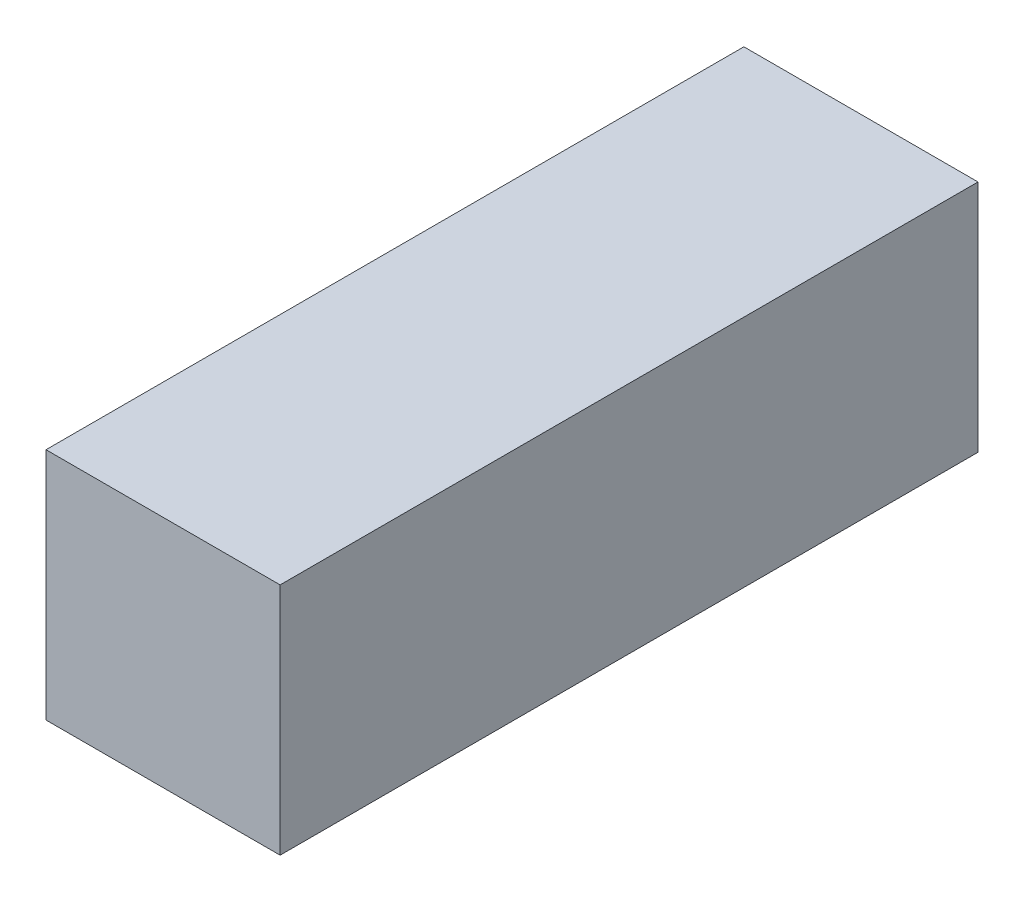
from build123d import *

# Parameters (mm, degrees)
SKETCH1_W            = 2667
SKETCH1_H            = 2667
SKETCH1_W_2          = 2590.8
SKETCH1_H_2          = 2590.8
BOSS_EXTRUDE1_DEPTH  = 7924.8
SKETCH2_W            = 2667
SKETCH2_H            = 2667
BOSS_EXTRUDE2_DEPTH  = 25.4
SKETCH3_W            = 139.7
SKETCH3_H            = 88.9
BOSS_EXTRUDE3_DEPTH  = 4876.8
SKETCH4_W            = 1219.2
SKETCH4_H            = 1016
BOSS_EXTRUDE4_DEPTH  = 152.4
LPATTERN1_COUNT      = 9
LPATTERN1_PITCH      = 142.24
LPATTERN1_COUNT_DIR2 = 9
LPATTERN1_PITCH_DIR2 = 91.44


with BuildPart() as part:
    # Sketch1 → Boss-Extrude1 (new body)
    with BuildSketch(Plane.XY):
        with Locations((0, 1295.4)):
            Rectangle(SKETCH1_W, SKETCH1_H)
        with Locations((0, 1295.4)):
            Rectangle(SKETCH1_W_2, SKETCH1_H_2, mode=Mode.SUBTRACT)
    extrude(amount=BOSS_EXTRUDE1_DEPTH)

    # Sketch2 → Boss-Extrude2 (add)
    with BuildSketch(Plane.XY.offset(7924.8)):
        with Locations((0, 1295.4)):
            Rectangle(SKETCH2_W, SKETCH2_H)
    extrude(amount=BOSS_EXTRUDE2_DEPTH)

    # Sketch3 → Boss-Extrude3 (add)
    with BuildSketch(Plane(origin=(0, 0, 7924.8), x_dir=(-1, 0, 0), z_dir=(0, 0, -1))):
        with Locations((-1225.55, 44.45)):
            Rectangle(SKETCH3_W, SKETCH3_H)
    boss_extrude3 = extrude(amount=BOSS_EXTRUDE3_DEPTH)

    # Sketch4 → Boss-Extrude4 (add)
    with BuildSketch(Plane(origin=(0, 0, 0), x_dir=(1, 0, 0), z_dir=(0, 1, 0))):
        with Locations((-666.776821408, -7400.988358872)):
            Rectangle(SKETCH4_W, SKETCH4_H)
    extrude(amount=BOSS_EXTRUDE4_DEPTH)

    # LPattern1: Boss-Extrude3 9 × 9
    with Locations(*[(-i * LPATTERN1_PITCH, j * LPATTERN1_PITCH_DIR2, 0) for i in range(LPATTERN1_COUNT) for j in range(LPATTERN1_COUNT_DIR2) if (i, j) != (0, 0)]):
        add(boss_extrude3)


solid = part.part
